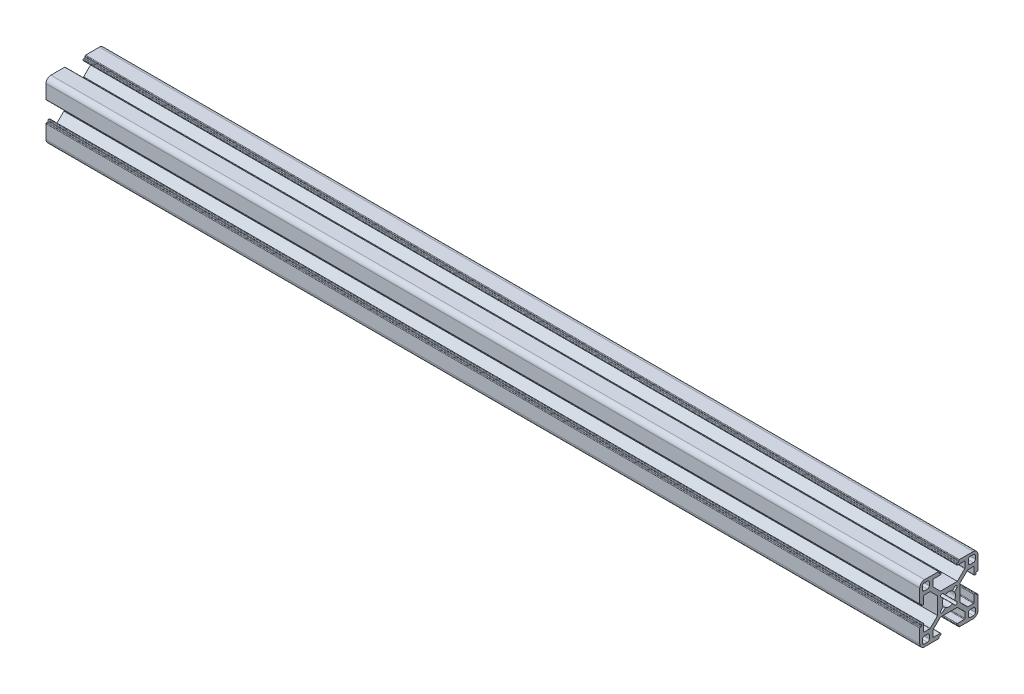
from build123d import *

# Parameters (mm, degrees)
SKETCH2_W                = 30
SKETCH2_H                = 30
BOSS_EXTRUDE1_DEPTH      = 450
SKETCH5_R                = 3.4
CUT_EXTRUDE2_DEPTH       = 451.49972253
CUT_EXTRUDE1_DEPTH       = 451.49972253
FILLET1_R                = 2.5
FILLET2_R                = 0.3
CIRPATTERN1_COUNT        = 4
FILLET1_OF_CIRPATTERN1_R = 2.5
FILLET2_OF_CIRPATTERN1_R = 0.3
CUT_EXTRUDE_1_DEPTH      = 10
CUT_EXTRUDE_1_DEPTH_BACK = 451.730118807
SKETCH_1_R               = 4.4


with BuildPart() as part:
    # Sketch2 → Boss-Extrude1 (new body)
    with BuildSketch(Plane(origin=(0, 0, 0), x_dir=(0, 0, -1), z_dir=(1, 0, 0))):
        Rectangle(SKETCH2_W, SKETCH2_H)
    extrude(amount=BOSS_EXTRUDE1_DEPTH)

    # Sketch5 → Cut-Extrude2 (cut, through all)
    with BuildSketch(Plane(origin=(450, 0, 0), x_dir=(0, 0, -1), z_dir=(1, 0, 0))):
        Circle(SKETCH5_R)
    extrude(amount=-CUT_EXTRUDE2_DEPTH, mode=Mode.SUBTRACT)

    # Sketch4 → Cut-Extrude1 (cut, through all)
    with BuildSketch(Plane(origin=(450, 0, 0), x_dir=(0, 0, -1), z_dir=(1, 0, 0))):
        with BuildLine():
            Line((-4.385786454, -5.8), (4.385786454, -5.8))
            Line((4.385786454, -5.8), (8.162132034, -9.57634558))
            ThreePointArc((8.162132034, -9.57634558), (8.22716386, -9.673672585), (8.25, -9.788477614))
            Line((8.25, -9.788477614), (8.25, -13))
            Line((8.25, -13), (4.1, -13))
            Line((4.1, -13), (4.1, -14))
            Line((4.1, -14), (5.1, -14))
            Line((5.1, -14), (5.1, -15))
            Line((5.1, -15), (-5.1, -15))
            Line((-5.1, -15), (-5.1, -14))
            Line((-5.1, -14), (-4.1, -14))
            Line((-4.1, -14), (-4.1, -13))
            Line((-4.1, -13), (-8.25, -13))
            Line((-8.25, -13), (-8.25, -9.788477614))
            ThreePointArc((-8.25, -9.788477614), (-8.22716386, -9.673672585), (-8.162132034, -9.57634558))
            Line((-8.162132034, -9.57634558), (-4.385786454, -5.8))
        make_face()
        with BuildLine():
            Line((11.05, -10.05), (12.65, -10.05))
            ThreePointArc((12.65, -10.05), (13.357106781, -10.342893219), (13.65, -11.05))
            Line((13.65, -11.05), (13.65, -12.65))
            ThreePointArc((13.65, -12.65), (13.357106781, -13.357106781), (12.65, -13.65))
            Line((12.65, -13.65), (11.05, -13.65))
            ThreePointArc((11.05, -13.65), (10.342893219, -13.357106781), (10.05, -12.65))
            Line((10.05, -12.65), (10.05, -11.05))
            ThreePointArc((10.05, -11.05), (10.342893219, -10.342893219), (11.05, -10.05))
        make_face()
        with BuildLine():
            Line((4.065863992, -3.00520382), (2.87527145, -1.814611278))
            ThreePointArc((2.87527145, -1.814611278), (2.404163056, -2.404163056), (1.814611278, -2.87527145))
            Line((1.814611278, -2.87527145), (3.00520382, -4.065863992))
            ThreePointArc((3.00520382, -4.065863992), (4.065863992, -4.065863992), (4.065863992, -3.00520382))
        make_face()
    cut_extrude1 = extrude(amount=-CUT_EXTRUDE1_DEPTH, mode=Mode.SUBTRACT)

    # Fillet1
    fillet1_edges = [part.edges().sort_by_distance(p)[0] for p in [
        (225, -15, -15),
    ]]
    fillet(fillet1_edges, radius=FILLET1_R)

    # Fillet2
    fillet2_edges = [part.edges().sort_by_distance(p)[0] for p in [
        (225, -14, -5.1),
        (225, -15, -5.1),
        (225, -14, -4.1),
        (225, -13, -4.1),
        (225, -13, -8.25),
        (225, -13, 8.25),
        (225, -13, 4.1),
        (225, -14, 4.1),
        (225, -14, 5.1),
        (225, -15, 5.1),
    ]]
    fillet(fillet2_edges, radius=FILLET2_R)

    # CirPattern1: Cut-Extrude1 ×4 about axis
    cirpattern1_axis = Axis((0, 0, 0), (1, 0, 0))
    for i in range(1, CIRPATTERN1_COUNT):
        add(cut_extrude1.rotate(cirpattern1_axis, i * 360 / CIRPATTERN1_COUNT), mode=Mode.SUBTRACT)

    # Fillet1 of CirPattern1
    fillet1_of_cirpattern1_edges = [part.edges().sort_by_distance(p)[0] for p in [
        (225, 15, -15),
        (225, 15, 15),
        (225, -15, 15),
    ]]
    fillet(fillet1_of_cirpattern1_edges, radius=FILLET1_OF_CIRPATTERN1_R)

    # Fillet2 of CirPattern1
    fillet2_of_cirpattern1_edges = [part.edges().sort_by_distance(p)[0] for p in [
        (225, 5.1, -14),
        (225, 5.1, -15),
        (225, 4.1, -14),
        (225, 4.1, -13),
        (225, 8.25, -13),
        (225, -8.25, -13),
        (225, -4.1, -13),
        (225, -4.1, -14),
        (225, -5.1, -14),
        (225, -5.1, -15),
        (225, 14, 5.1),
        (225, 15, 5.1),
        (225, 14, 4.1),
        (225, 13, 4.1),
        (225, 13, 8.25),
        (225, 13, -8.25),
        (225, 13, -4.1),
        (225, 14, -4.1),
        (225, 14, -5.1),
        (225, 15, -5.1),
        (225, -5.1, 14),
        (225, -5.1, 15),
        (225, -4.1, 14),
        (225, -4.1, 13),
        (225, -8.25, 13),
        (225, 8.25, 13),
        (225, 4.1, 13),
        (225, 4.1, 14),
        (225, 5.1, 14),
        (225, 5.1, 15),
    ]]
    fillet(fillet2_of_cirpattern1_edges, radius=FILLET2_OF_CIRPATTERN1_R)

    # 草图1 → 切除-拉伸1 (cut, two sides: drawn at the far end of the back side and taken through both)
    with BuildSketch(Plane(origin=(0, 5.8, 0), x_dir=(1, 0, 0), z_dir=(0, 1, 0)).offset(-CUT_EXTRUDE_1_DEPTH_BACK)):
        with Locations((285.290394709, 0)):
            Circle(SKETCH_1_R)
    extrude(amount=CUT_EXTRUDE_1_DEPTH + CUT_EXTRUDE_1_DEPTH_BACK, mode=Mode.SUBTRACT)


solid = part.part
